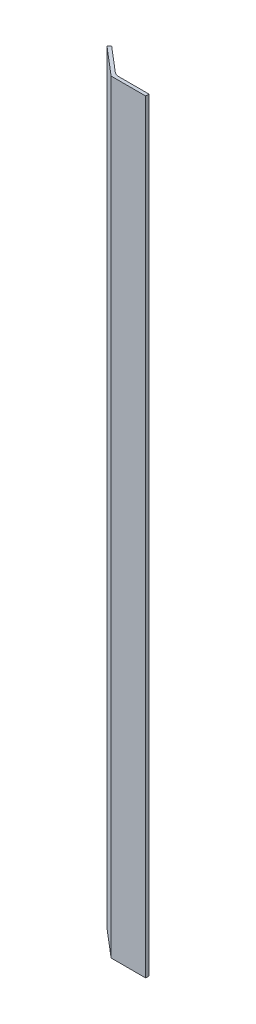
from build123d import *

# Parameters (mm, degrees)
EXTRUDE_START   = 40
EXTRUDE_1_DEPTH = 460


with BuildPart() as part:
    # Эскиз1 → Вытянуть1 (new body)
    with BuildSketch(Plane(origin=(0, 0, 0), x_dir=(1, 0, 0), z_dir=(0, 1, 0)).offset(EXTRUDE_START)):
        with BuildLine():
            Line((-20.508447565, 12.792651291), (-19.211965496, 14.315521688))
            Line((-19.211965496, 14.315521688), (-4.37520086, 1.680230584))
            ThreePointArc((-4.37520086, 1.680230584), (-2.860623355, 0.794693725), (-1.133379225, 0.48688167))
            Line((-1.133379225, 0.48688167), (17.122829042, 0.48688167))
            Line((17.122829042, 0.48688167), (17.122829042, -1.51311833))
            Line((17.122829042, -1.51311833), (-3.70464164, -1.51311833))
            Line((-3.70464164, -1.51311833), (-20.508447565, 12.792651291))
        make_face()
    extrude(amount=EXTRUDE_1_DEPTH)


solid = part.part
